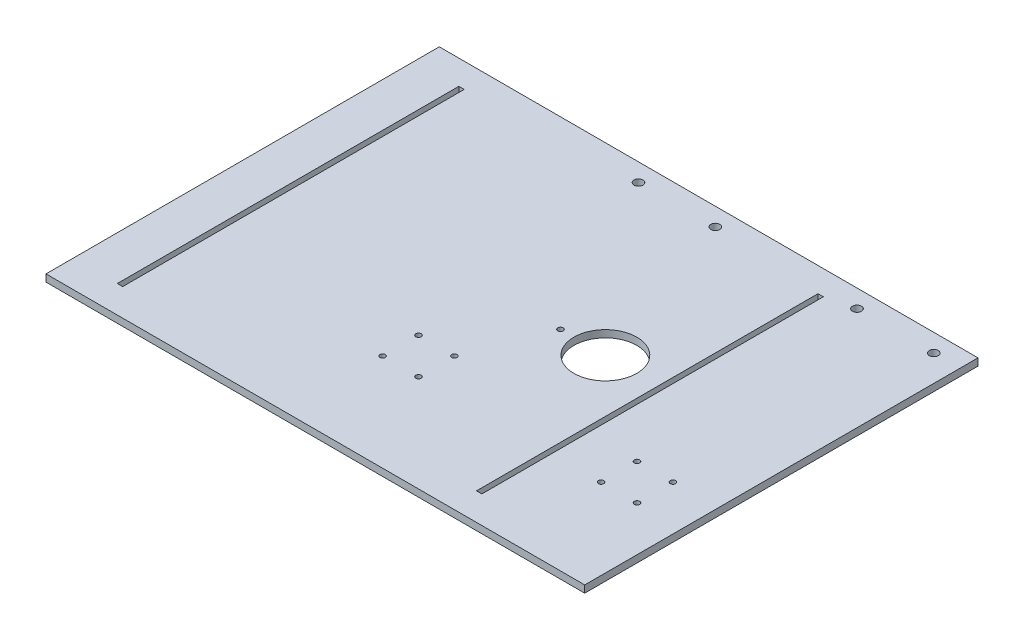
from build123d import *

# Parameters (mm, degrees)
SKETCH1_W               = 300
SKETCH1_H               = 219
SKETCH1_W_2             = 3
SKETCH1_H_2             = 190.1710485
BOSS_EXTRUDE1_DEPTH     = 4
SKETCH2_R               = 17.5
CUT_EXTRUDE2_DEPTH      = 186.758579883
CUT_EXTRUDE3_DEPTH      = 186.758579883
CUT_EXTRUDE3_DEPTH_BACK = 186.758579883
SKETCH3_R               = 1.5
CUT_EXTRUDE4_DEPTH      = 186.758579883
CUT_EXTRUDE4_DEPTH_BACK = 186.758579883
SKETCH4_R               = 1.5
CUT_EXTRUDE5_DEPTH      = 186.758579883
CUT_EXTRUDE5_DEPTH_BACK = 186.758579883
SKETCH5_R               = 2.5
CUT_EXTRUDE6_DEPTH      = 186.758579883
CUT_EXTRUDE6_DEPTH_BACK = 186.758579883
SKETCH6_R               = 2.5
CUT_EXTRUDE7_DEPTH      = 186.758579883
CUT_EXTRUDE7_DEPTH_BACK = 186.758579883
SKETCH7_R               = 1.5


with BuildPart() as part:
    # Sketch1 → Boss-Extrude1 (new body)
    with BuildSketch(Plane(origin=(0, 0, 0), x_dir=(1, 0, 0), z_dir=(0, 1, 0))):
        Rectangle(SKETCH1_W, SKETCH1_H)
        with Locations((-124, 0.80041533)):
            Rectangle(SKETCH1_W_2, SKETCH1_H_2, mode=Mode.SUBTRACT)
        with Locations((76, 0.80041533)):
            Rectangle(SKETCH1_W_2, SKETCH1_H_2, mode=Mode.SUBTRACT)
    extrude(amount=BOSS_EXTRUDE1_DEPTH)

    # Sketch2 → Cut-Extrude2 (cut, through all)
    with BuildSketch(Plane(origin=(0, 0, 0), x_dir=(-1, 0, 0), z_dir=(0, -1, 0))):
        with Locations(Location((-45, 7, 0), (0, 0, 90))):
            Circle(SKETCH2_R)
    extrude(amount=-CUT_EXTRUDE2_DEPTH, mode=Mode.SUBTRACT)

    # Sketch3 → Cut-Extrude3 (cut, two sides: drawn at the far end of the back side and taken through both)
    with BuildSketch(Plane(origin=(0, 0, 0), x_dir=(-1, 0, 0), z_dir=(0, -1, 0)).offset(-CUT_EXTRUDE3_DEPTH_BACK)):
        with Locations(Location((-125, -55.39, 0), (0, 0, 90))):
            Circle(SKETCH3_R)
        with Locations(Location((-125, -35.39, 0), (0, 0, 90))):
            Circle(SKETCH3_R)
        with Locations(Location((-105, -35.39, 0), (0, 0, 90))):
            Circle(SKETCH3_R)
        with Locations(Location((-105, -55.39, 0), (0, 0, 90))):
            Circle(SKETCH3_R)
    extrude(amount=CUT_EXTRUDE3_DEPTH + CUT_EXTRUDE3_DEPTH_BACK, mode=Mode.SUBTRACT)

    # Sketch4 → Cut-Extrude4 (cut, two sides: drawn at the far end of the back side and taken through both)
    with BuildSketch(Plane(origin=(0, 0, 0), x_dir=(-1, 0, 0), z_dir=(0, -1, 0)).offset(-CUT_EXTRUDE4_DEPTH_BACK)):
        with Locations(Location((-3.32, -55.39, 0), (0, 0, 90))):
            Circle(SKETCH4_R)
        with Locations(Location((-3.32, -35.39, 0), (0, 0, 90))):
            Circle(SKETCH4_R)
        with Locations(Location((16.68, -35.39, 0), (0, 0, 90))):
            Circle(SKETCH4_R)
        with Locations(Location((16.68, -55.39, 0), (0, 0, 90))):
            Circle(SKETCH4_R)
    extrude(amount=CUT_EXTRUDE4_DEPTH + CUT_EXTRUDE4_DEPTH_BACK, mode=Mode.SUBTRACT)

    # Sketch5 → Cut-Extrude5 (cut, two sides: drawn at the far end of the back side and taken through both)
    with BuildSketch(Plane(origin=(0, 0, 0), x_dir=(-1, 0, 0), z_dir=(0, -1, 0)).offset(-CUT_EXTRUDE5_DEPTH_BACK)):
        with Locations(Location((-135.39, 99.5, 0), (0, 0, 90))):
            Circle(SKETCH5_R)
        with Locations(Location((-92.61, 99.5, 0), (0, 0, 90))):
            Circle(SKETCH5_R)
    extrude(amount=CUT_EXTRUDE5_DEPTH + CUT_EXTRUDE5_DEPTH_BACK, mode=Mode.SUBTRACT)

    # Sketch6 → Cut-Extrude6 (cut, two sides: drawn at the far end of the back side and taken through both)
    with BuildSketch(Plane.XZ.offset(-CUT_EXTRUDE6_DEPTH_BACK)):
        with Locations(Location((13.71, -99.5, 0), (0, 0, 270))):
            Circle(SKETCH6_R)
        with Locations(Location((-29.07, -99.5, 0), (0, 0, 270))):
            Circle(SKETCH6_R)
    extrude(amount=CUT_EXTRUDE6_DEPTH + CUT_EXTRUDE6_DEPTH_BACK, mode=Mode.SUBTRACT)

    # Sketch7 → Cut-Extrude7 (cut, two sides: drawn at the far end of the back side and taken through both)
    with BuildSketch(Plane(origin=(0, 4, 0), x_dir=(1, 0, 0), z_dir=(0, 1, 0)).offset(-CUT_EXTRUDE7_DEPTH_BACK)):
        with Locations(Location((20, 7, 0), (0, 0, 270))):
            Circle(SKETCH7_R)
    extrude(amount=CUT_EXTRUDE7_DEPTH + CUT_EXTRUDE7_DEPTH_BACK, mode=Mode.SUBTRACT)


solid = part.part
